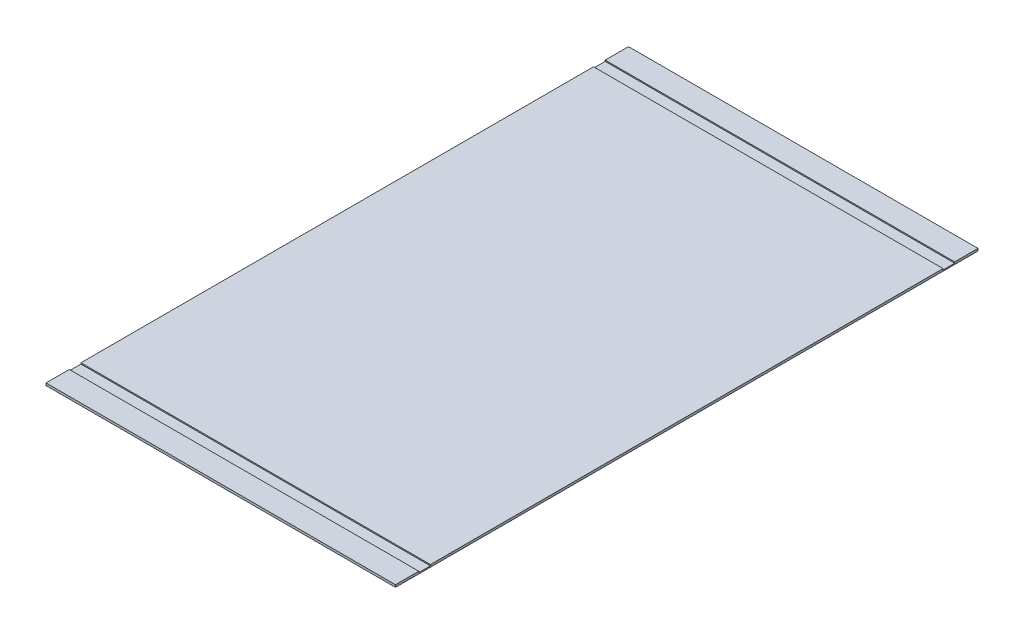
from build123d import *

# Parameters (mm, degrees)
SKETCH1_W           = 381
SKETCH1_H           = 635
BOSS_EXTRUDE1_DEPTH = 2.54
SKETCH2_W           = 381
SKETCH2_H           = 12.7
CUT_EXTRUDE1_DEPTH  = 1.27


with BuildPart() as part:
    # Sketch1 → Boss-Extrude1 (new body)
    with BuildSketch(Plane(origin=(0, 0, 0), x_dir=(1, 0, 0), z_dir=(0, 1, 0))):
        with Locations((-190.5, 317.5)):
            Rectangle(SKETCH1_W, SKETCH1_H)
    extrude(amount=BOSS_EXTRUDE1_DEPTH)

    # Sketch2 → Cut-Extrude1 (cut)
    with BuildSketch(Plane(origin=(0, 2.54, 0), x_dir=(1, 0, 0), z_dir=(0, 1, 0))):
        with Locations((-190.5, 603.25)):
            Rectangle(SKETCH2_W, SKETCH2_H)
        with Locations((-190.5, 31.75)):
            Rectangle(SKETCH2_W, SKETCH2_H)
    extrude(amount=-CUT_EXTRUDE1_DEPTH, mode=Mode.SUBTRACT)


solid = part.part
